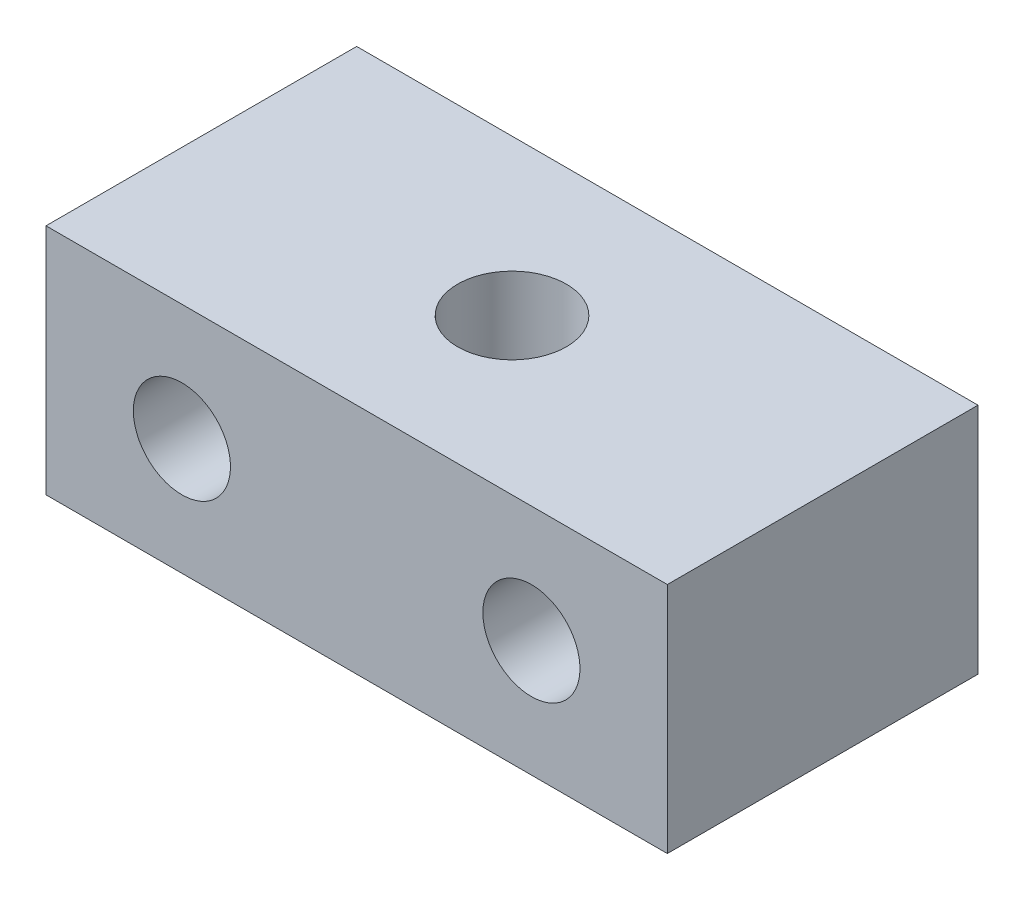
from build123d import *

# Parameters (mm, degrees)
SKETCH1_W           = 50.8
SKETCH1_H           = 19.05
SKETCH1_R           = 3.96875
BOSS_EXTRUDE1_DEPTH = 12.7
SKETCH2_R           = 4.445
CUT_EXTRUDE1_DEPTH  = 35.195796525


with BuildPart() as part:
    # Sketch1 → Boss-Extrude1 (new, symmetric)
    with BuildSketch(Plane.XY):
        Rectangle(SKETCH1_W, SKETCH1_H)
        with Locations(Location((-14.2875, 0, 0), (0, 0, 180))):
            Circle(SKETCH1_R, mode=Mode.SUBTRACT)
        with Locations(Location((14.2875, 0, 0), (0, 0, 180))):
            Circle(SKETCH1_R, mode=Mode.SUBTRACT)
    extrude(amount=BOSS_EXTRUDE1_DEPTH, both=True)

    # Sketch2 → Cut-Extrude1 (cut, through all)
    with BuildSketch(Plane(origin=(0, 9.525, 0), x_dir=(1, 0, 0), z_dir=(0, 1, 0))):
        with Locations(Location((0, 0, 0), (0, 0, 270))):
            Circle(SKETCH2_R)
    extrude(amount=-CUT_EXTRUDE1_DEPTH, mode=Mode.SUBTRACT)


solid = part.part
